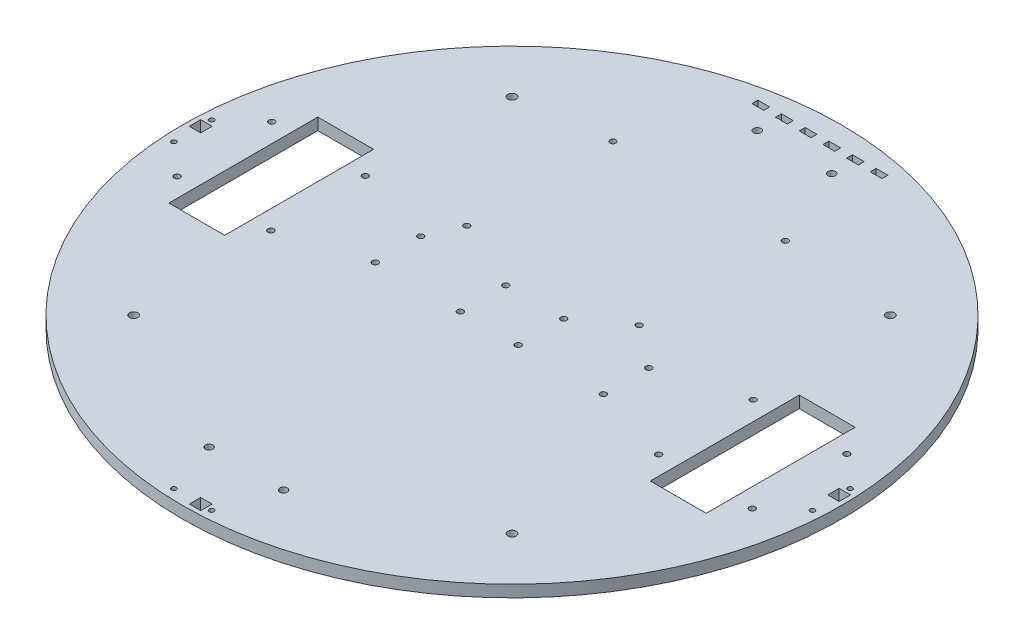
from build123d import *

# Parameters (mm, degrees)
SKETCH1_R           = 177
SKETCH1_R_2         = 1.6
SKETCH1_R_3         = 2.2479
SKETCH1_R_4         = 2.000000064
SKETCH1_R_5         = 1.3
SKETCH1_R_6         = 1.29999994
SKETCH1_W           = 6.15
SKETCH1_H           = 6.15
SKETCH1_W_2         = 30
SKETCH1_H_2         = 80
SKETCH1_W_3         = 6.35
SKETCH1_H_3         = 3.175
BOSS_EXTRUDE1_DEPTH = 6.35


with BuildPart() as part:
    # Sketch1 → Boss-Extrude1 (new body)
    with BuildSketch(Plane(origin=(0, 0, 0), x_dir=(1, 0, 0), z_dir=(0, 1, 0))):
        with Locations(Location((0, 0, 0), (0, 0, 270))):
            Circle(SKETCH1_R)
        with Locations(Location((-154.46, 25.4, 0), (0, 0, 270))):
            Circle(SKETCH1_R_2, mode=Mode.SUBTRACT)
        with Locations(Location((-154.46, -25.4, 0), (0, 0, 270))):
            Circle(SKETCH1_R_2, mode=Mode.SUBTRACT)
        with Locations(Location((154.46, 25.4, 0), (0, 0, 270))):
            Circle(SKETCH1_R_2, mode=Mode.SUBTRACT)
        with Locations(Location((154.46, -25.4, 0), (0, 0, 270))):
            Circle(SKETCH1_R_2, mode=Mode.SUBTRACT)
        with Locations(Location((-104.14, 25.4, 0), (0, 0, 270))):
            Circle(SKETCH1_R_2, mode=Mode.SUBTRACT)
        with Locations(Location((-104.14, -25.4, 0), (0, 0, 270))):
            Circle(SKETCH1_R_2, mode=Mode.SUBTRACT)
        with Locations(Location((104.14, 25.4, 0), (0, 0, 270))):
            Circle(SKETCH1_R_2, mode=Mode.SUBTRACT)
        with Locations(Location((104.14, -25.4, 0), (0, 0, 270))):
            Circle(SKETCH1_R_2, mode=Mode.SUBTRACT)
        with Locations(Location((-53.7, 107.95, 0), (0, 0, 270))):
            Circle(SKETCH1_R_2, mode=Mode.SUBTRACT)
        with Locations(Location((38.8, 107.95, 0), (0, 0, 270))):
            Circle(SKETCH1_R_2, mode=Mode.SUBTRACT)
        with Locations(Location((-53.7, 29.45, 0), (0, 0, 270))):
            Circle(SKETCH1_R_2, mode=Mode.SUBTRACT)
        with Locations(Location((38.8, 29.45, 0), (0, 0, 270))):
            Circle(SKETCH1_R_2, mode=Mode.SUBTRACT)
        with Locations(Location((-101.6, -101.6, 0), (0, 0, 270))):
            Circle(SKETCH1_R_3, mode=Mode.SUBTRACT)
        with Locations(Location((101.6, -101.6, 0), (0, 0, 270))):
            Circle(SKETCH1_R_3, mode=Mode.SUBTRACT)
        with Locations(Location((-101.6, 101.6, 0), (0, 0, 270))):
            Circle(SKETCH1_R_3, mode=Mode.SUBTRACT)
        with Locations(Location((101.6, 101.6, 0), (0, 0, 270))):
            Circle(SKETCH1_R_3, mode=Mode.SUBTRACT)
        with Locations(Location((-20, -142.687006289, 0), (0, 0, 270))):
            Circle(SKETCH1_R_4, mode=Mode.SUBTRACT)
        with Locations(Location((20, -142.687006289, 0), (0, 0, 270))):
            Circle(SKETCH1_R_4, mode=Mode.SUBTRACT)
        with Locations(Location((-20, 151.719279026, 0), (0, 0, 270))):
            Circle(SKETCH1_R_4, mode=Mode.SUBTRACT)
        with Locations(Location((20, 151.719279026, 0), (0, 0, 270))):
            Circle(SKETCH1_R_4, mode=Mode.SUBTRACT)
        with Locations(Location((-10.125, -171.45, 0), (0, 0, 270))):
            Circle(SKETCH1_R_5, mode=Mode.SUBTRACT)
        with Locations(Location((10.125, -171.45, 0), (0, 0, 270))):
            Circle(SKETCH1_R_6, mode=Mode.SUBTRACT)
        with Locations(Location((171.45, -10.125, 0), (0, 0, 270))):
            Circle(SKETCH1_R_5, mode=Mode.SUBTRACT)
        with Locations(Location((171.45, 10.125, 0), (0, 0, 270))):
            Circle(SKETCH1_R_5, mode=Mode.SUBTRACT)
        with Locations(Location((-171.45, -10.125, 0), (0, 0, 270))):
            Circle(SKETCH1_R_5, mode=Mode.SUBTRACT)
        with Locations(Location((-171.45, 10.125, 0), (0, 0, 270))):
            Circle(SKETCH1_R_5, mode=Mode.SUBTRACT)
        with Locations(Location((-61.26, 12.194, 0), (0, 0, 270))):
            Circle(SKETCH1_R_2, mode=Mode.SUBTRACT)
        with Locations(Location((-61.26, -12.19, 0), (0, 0, 270))):
            Circle(SKETCH1_R_2, mode=Mode.SUBTRACT)
        with Locations(Location((-15.54, 12.194, 0), (0, 0, 270))):
            Circle(SKETCH1_R_2, mode=Mode.SUBTRACT)
        with Locations(Location((-15.54, -12.19, 0), (0, 0, 270))):
            Circle(SKETCH1_R_2, mode=Mode.SUBTRACT)
        with Locations(Location((61.26, -12.19, 0), (0, 0, 270))):
            Circle(SKETCH1_R_2, mode=Mode.SUBTRACT)
        with Locations(Location((15.54, -12.19, 0), (0, 0, 270))):
            Circle(SKETCH1_R_2, mode=Mode.SUBTRACT)
        with Locations(Location((15.54, 12.194, 0), (0, 0, 270))):
            Circle(SKETCH1_R_2, mode=Mode.SUBTRACT)
        with Locations(Location((61.26, 12.194, 0), (0, 0, 270))):
            Circle(SKETCH1_R_2, mode=Mode.SUBTRACT)
        with Locations((171.45, 4.26)):
            Rectangle(SKETCH1_W, SKETCH1_H, mode=Mode.SUBTRACT)
        with Locations((-129.3, 0)):
            Rectangle(SKETCH1_W_2, SKETCH1_H_2, mode=Mode.SUBTRACT)
        with Locations((129.3, 0)):
            Rectangle(SKETCH1_W_2, SKETCH1_H_2, mode=Mode.SUBTRACT)
        with Locations((4.26, -171.45)):
            Rectangle(SKETCH1_W, SKETCH1_H, mode=Mode.SUBTRACT)
        with Locations((-171.45, 4.26)):
            Rectangle(SKETCH1_W, SKETCH1_H, mode=Mode.SUBTRACT)
        with Locations((-18.119952608, 164.452014647)):
            Rectangle(SKETCH1_W_3, SKETCH1_H_3, mode=Mode.SUBTRACT)
        with Locations((-30.819952608, 164.452014647)):
            Rectangle(SKETCH1_W_3, SKETCH1_H_3, mode=Mode.SUBTRACT)
        with Locations((-5.419952608, 164.452014647)):
            Rectangle(SKETCH1_W_3, SKETCH1_H_3, mode=Mode.SUBTRACT)
        with Locations((7.280047392, 164.452014647)):
            Rectangle(SKETCH1_W_3, SKETCH1_H_3, mode=Mode.SUBTRACT)
        with Locations((19.980047392, 164.452014647)):
            Rectangle(SKETCH1_W_3, SKETCH1_H_3, mode=Mode.SUBTRACT)
        with Locations((32.680047392, 164.452014647)):
            Rectangle(SKETCH1_W_3, SKETCH1_H_3, mode=Mode.SUBTRACT)
    extrude(amount=BOSS_EXTRUDE1_DEPTH)


solid = part.part
